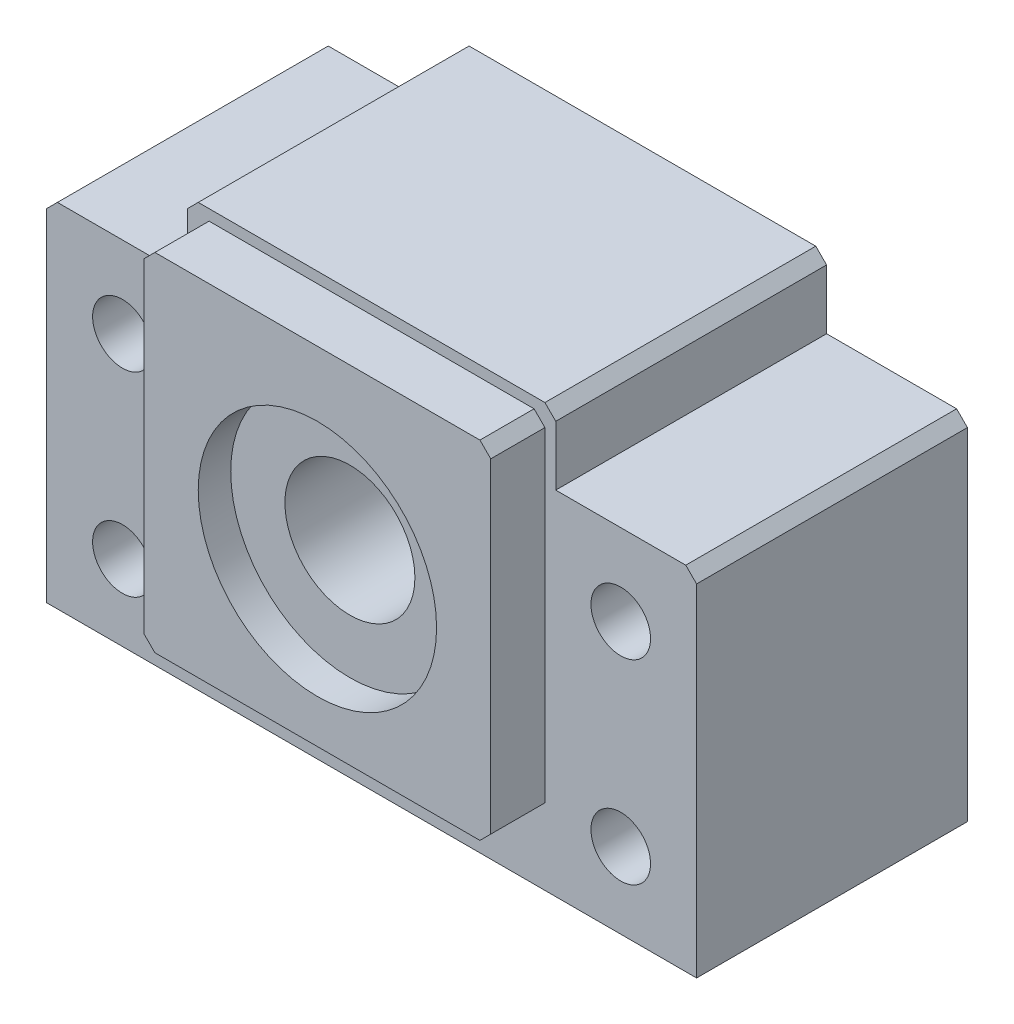
from build123d import *

# Parameters (mm, degrees)
EXTRUDE_1_DEPTH     = 12.5
SKETCH_2_W          = 32
SKETCH_2_H          = 32
EXTRUDE_2_DEPTH     = 5
CHAMFER_1_SIZE      = 1
CHAMFER_2_SIZE      = 1
SKETCH_3_R          = 2.75
CUT_EXTRUDE_1_DEPTH = 46.194717612
CHAMFER_3_SIZE      = 1
SKETCH_4_R          = 6
CUT_EXTRUDE_2_DEPTH = 49.141068746
SKETCH_5_R          = 11
CUT_EXTRUDE_3_DEPTH = 3


with BuildPart() as part:
    # 草图1 → 凸台-拉伸1 (new, symmetric)
    with BuildSketch(Plane.XY):
        Polygon((-30, 16.25), (-30, -16.25), (30, -16.25), (30, 16.25), (17, 16.25), (17, 22.75), (-17, 22.75), (-17, 16.25), align=None)
    extrude(amount=EXTRUDE_1_DEPTH, both=True)

    # 草图2 → 凸台-拉伸2 (add)
    with BuildSketch(Plane.XY.offset(12.5)):
        with Locations((0, 5.75)):
            Rectangle(SKETCH_2_W, SKETCH_2_H)
    extrude(amount=EXTRUDE_2_DEPTH)

    # 倒角1
    chamfer_1_edges = [part.edges().sort_by_distance(p)[0] for p in [
        (16, -10.25, 15),
        (-16, -10.25, 15),
        (16, 21.75, 15),
        (-16, 21.75, 15),
    ]]
    chamfer(chamfer_1_edges, length=CHAMFER_1_SIZE)

    # 倒角2
    chamfer_2_edges = [part.edges().sort_by_distance(p)[0] for p in [
        (-30, 16.25, 0),
        (30, 16.25, 0),
    ]]
    chamfer(chamfer_2_edges, length=CHAMFER_2_SIZE)

    # 草图3 → 切除-拉伸1 (cut, through all)
    with BuildSketch(Plane.XY.offset(12.5)):
        with Locations((-23, 8.75)):
            Circle(SKETCH_3_R)
        with Locations((-23, -9.25)):
            Circle(SKETCH_3_R)
    cut_extrude_1 = extrude(amount=-CUT_EXTRUDE_1_DEPTH, mode=Mode.SUBTRACT)

    # 镜向1: 切除-拉伸1 across plane
    add(cut_extrude_1.mirror(Plane(origin=(0, 0, 0), x_dir=(0, 0, 1), z_dir=(1, 0, 0))), mode=Mode.SUBTRACT)

    # 倒角3
    chamfer_3_edges = [part.edges().sort_by_distance(p)[0] for p in [
        (17, 22.75, 0),
        (-17, 22.75, 0),
    ]]
    chamfer(chamfer_3_edges, length=CHAMFER_3_SIZE)

    # 草图4 → 切除-拉伸2 (cut, through all)
    with BuildSketch(Plane.XY.offset(17.5)):
        with Locations((0, 4.75)):
            Circle(SKETCH_4_R)
    extrude(amount=-CUT_EXTRUDE_2_DEPTH, mode=Mode.SUBTRACT)

    # 草图5 → 切除-拉伸3 (cut)
    with BuildSketch(Plane.XY.offset(17.5)):
        with Locations((0, 4.75)):
            Circle(SKETCH_5_R)
    extrude(amount=-CUT_EXTRUDE_3_DEPTH, mode=Mode.SUBTRACT)


solid = part.part
